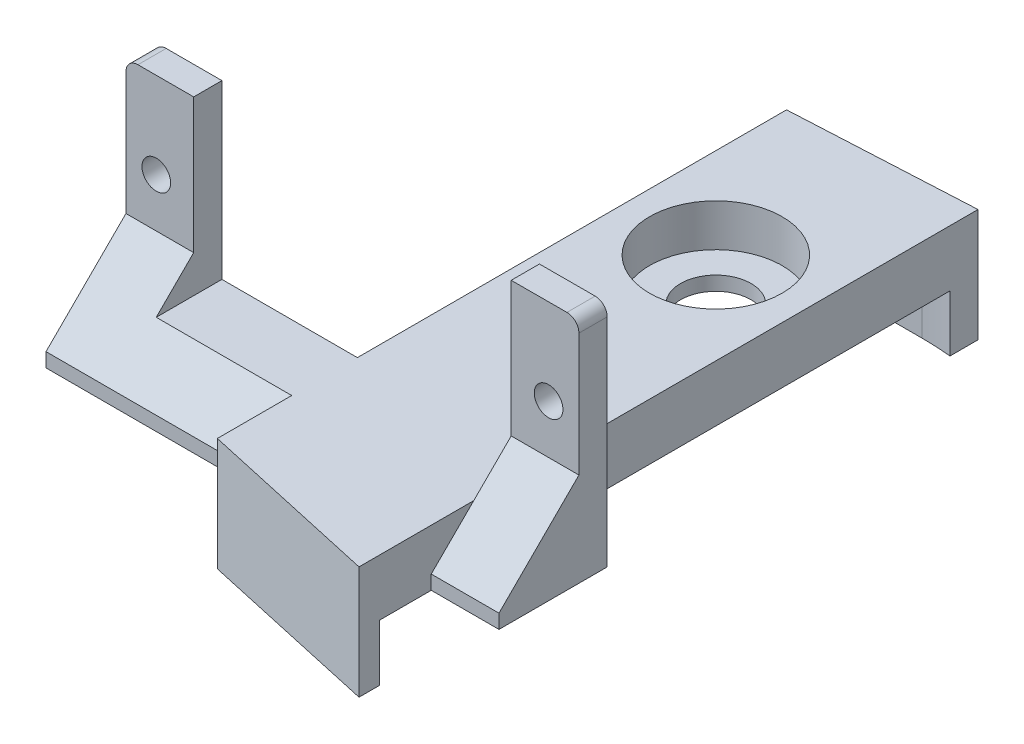
from build123d import *

# Parameters (mm, degrees)
SKETCH1_R                       = 1.016
BOSS_EXTRUDE1_DEPTH             = 2
SKETCH2_R                       = 4.7
BOSS_EXTRUDE2_DEPTH             = 3
BOSS_EXTRUDE5_DEPTH             = 8
BOSS_EXTRUDE6_REACH             = 45.704
BOSS_EXTRUDE6_DIRECTION_2_REACH = 45.704
SKETCH4_W                       = 22.5
SKETCH4_H                       = 14.127681706
CUT_EXTRUDE1_DEPTH              = 7
SKETCH5_R                       = 2.5
BOSS_EXTRUDE7_DEPTH             = 1


with BuildPart() as part:
    # Sketch1 → Boss-Extrude1 (new body)
    # profile 1 of 4: a face of its own
    with BuildSketch(Plane.XY):
        with BuildLine():
            Line((-16.05, 5.25), (-16.05, -5.25))
            ThreePointArc((-16.05, -5.25), (-15.801040764, -5.851040764), (-15.2, -6.1))
            Line((-15.2, -6.1), (-11.25, -6.1))
            Line((-11.25, -6.1), (-11.25, 6.1))
            Line((-11.25, 6.1), (-15.2, 6.1))
            ThreePointArc((-15.2, 6.1), (-15.801040764, 5.851040764), (-16.05, 5.25))
        make_face()
        with Locations((-13.9, 0)):
            Circle(SKETCH1_R, mode=Mode.SUBTRACT)
    # profile 2 of 4: a face of its own
    with BuildSketch(Plane.XY):
        with BuildLine():
            Line((16.05, 5.25), (16.05, -5.25))
            ThreePointArc((16.05, -5.25), (15.801040764, -5.851040764), (15.2, -6.1))
            Line((15.2, -6.1), (11.25, -6.1))
            Line((11.25, -6.1), (11.25, 6.094097151))
            Line((11.25, 6.094097151), (15.2, 6.1))
            ThreePointArc((15.2, 6.1), (15.801040764, 5.851040764), (16.05, 5.25))
        make_face()
        with Locations((13.9, 0)):
            Circle(SKETCH1_R, mode=Mode.SUBTRACT)
    # profile 3 of 4: a face of its own
    with BuildSketch(Plane.XY):
        with BuildLine():
            ThreePointArc((15.2, -6.1), (15.801040764, -5.851040764), (16.05, -5.25))
            Line((16.05, -5.25), (16.05, -6.1))
            Line((16.05, -6.1), (15.2, -6.1))
        make_face()
    # profile 4 of 4: a face of its own
    with BuildSketch(Plane.XY):
        with BuildLine():
            ThreePointArc((-16.05, -5.25), (-15.801040764, -5.851040764), (-15.2, -6.1))
            Line((-15.2, -6.1), (-16.05, -6.1))
            Line((-16.05, -6.1), (-16.05, -5.25))
        make_face()
    extrude(amount=BOSS_EXTRUDE1_DEPTH)

    # Sketch2 → Boss-Extrude2 (add)
    with BuildSketch(Plane.XZ.offset(6.1)):
        Polygon((16.05, 2), (11.25, 2), (11.25, 12.784507897), (-1.65, 9.925449639), (-1.65, 2), (-16.05, 2), (-16.05, 0), (-1.65, 0), (-1.65, -30.41033757), (11.25, -31.079190458), (11.25, 0), (16.05, 0), align=None)
        with Locations((4.75, -19)):
            Circle(SKETCH2_R, mode=Mode.SUBTRACT)
    extrude(amount=BOSS_EXTRUDE2_DEPTH)

    # Sketch2<3> → Boss-Extrude5 (add)
    with BuildSketch(Plane.XZ.offset(6.1)):
        with BuildLine():
            Line((11.201492875, 11.3190285), (11.25, 11.337476622))
            Line((11.25, 11.337476622), (11.25, 12.784507897))
            Line((11.25, 12.784507897), (-1.65, 9.925449639))
            Line((-1.65, 9.925449639), (-1.65, 7.134527797))
            ThreePointArc((-1.65, 7.134527797), (0.2068653, 8.32459199), (2.276136625, 9.087689437))
            Line((2.276136625, 9.087689437), (11.201492875, 11.3190285))
        make_face()
        with BuildLine():
            ThreePointArc((4.75, -29.2), (1.356725547, -28.619027419), (-1.65, -26.942291861))
            Line((-1.65, -26.942291861), (-1.65, -30.41033757))
            Line((-1.65, -30.41033757), (11.25, -31.079190458))
            Line((11.25, -31.079190458), (11.25, -29.090542554))
            ThreePointArc((11.25, -29.090542554), (10.201413429, -29.172617079), (9.149976222, -29.2))
            Line((9.149976222, -29.2), (4.75, -29.2))
        make_face()
    extrude(amount=BOSS_EXTRUDE5_DEPTH)

    # Boss-Extrude6: up to this face of the body (flat: up to its plane)
    boss_extrude6_end = Plane(part.part.faces().sort_by_distance((16.05, -1.925, 1))[0])
    # Sketch3 → Boss-Extrude6 (add, up to the picked face)
    with BuildSketch(Plane(origin=(11.25, 0, 0), x_dir=(0, 0, -1), z_dir=(1, 0, 0)), mode=Mode.PRIVATE) as boss_extrude6_sk1:
        Polygon((-7.665828596, -9.1), (-2, -3.457464127), (-2, -9.1), align=None)
    boss_extrude6_tool1 = split(extrude(boss_extrude6_sk1.sketch, amount=BOSS_EXTRUDE6_REACH, mode=Mode.PRIVATE), bisect_by=boss_extrude6_end, keep=Keep.BOTH, mode=Mode.PRIVATE)
    add(boss_extrude6_tool1.solids().sort_by(Axis((11.25, -7.219155, 3.88861), (1, 0, 0)))[0])

    # Boss-Extrude6 direction 2: up to this face of the body (flat: up to its plane)
    boss_extrude6_direction_2_end = Plane(part.part.faces().sort_by_distance((-16.05, -1.925, 1))[0])
    # Sketch3 → Boss-Extrude6 direction 2 (add, up to the picked face)
    with BuildSketch(Plane(origin=(11.25, 0, 0), x_dir=(0, 0, -1), z_dir=(1, 0, 0)), mode=Mode.PRIVATE) as boss_extrude6_direction_2_sk1:
        Polygon((-7.665828596, -9.1), (-2, -3.457464127), (-2, -9.1), align=None)
    boss_extrude6_direction_2_tool1 = split(extrude(boss_extrude6_direction_2_sk1.sketch, amount=-BOSS_EXTRUDE6_DIRECTION_2_REACH, mode=Mode.PRIVATE), bisect_by=boss_extrude6_direction_2_end, keep=Keep.BOTH, mode=Mode.PRIVATE)
    add(boss_extrude6_direction_2_tool1.solids().sort_by(Axis((11.25, -7.219155, 3.88861), (-1, 0, 0)))[0])

    # Sketch4 → Cut-Extrude1 (cut)
    with BuildSketch(Plane(origin=(0, -6.1, 0), x_dir=(1, 0, 0), z_dir=(0, 1, 0))):
        with Locations((0, -7.063840853)):
            Rectangle(SKETCH4_W, SKETCH4_H)
    extrude(amount=CUT_EXTRUDE1_DEPTH, mode=Mode.SUBTRACT)

    # Sketch5 → Boss-Extrude7 (add)
    with BuildSketch(Plane.XZ.offset(9.1)):
        with BuildLine():
            Line((-1.65, 0), (-1.65, -26.942291861))
            ThreePointArc((-1.65, -26.942291861), (1.356725547, -28.619027419), (4.75, -29.2))
            Line((4.75, -29.2), (9.149976222, -29.2))
            ThreePointArc((9.149976222, -29.2), (10.201413429, -29.172617079), (11.25, -29.090542554))
            Line((11.25, -29.090542554), (11.25, 0))
            Line((11.25, 0), (16.05, 0))
            Line((16.05, 0), (16.05, 7.665828596))
            Line((16.05, 7.665828596), (11.25, 7.665828596))
            Line((11.25, 7.665828596), (11.25, 11.337476622))
            Line((11.25, 11.337476622), (11.201492875, 11.3190285))
            Line((11.201492875, 11.3190285), (2.276136625, 9.087689437))
            ThreePointArc((2.276136625, 9.087689437), (0.2068653, 8.32459199), (-1.65, 7.134527797))
            Line((-1.65, 7.134527797), (-1.65, 7.665828596))
            Line((-1.65, 7.665828596), (-16.05, 7.665828596))
            Line((-16.05, 7.665828596), (-16.05, 0))
            Line((-16.05, 0), (-1.65, 0))
        make_face()
        with Locations((4.75, -19)):
            Circle(SKETCH5_R, mode=Mode.SUBTRACT)
    extrude(amount=BOSS_EXTRUDE7_DEPTH)


solid = part.part
